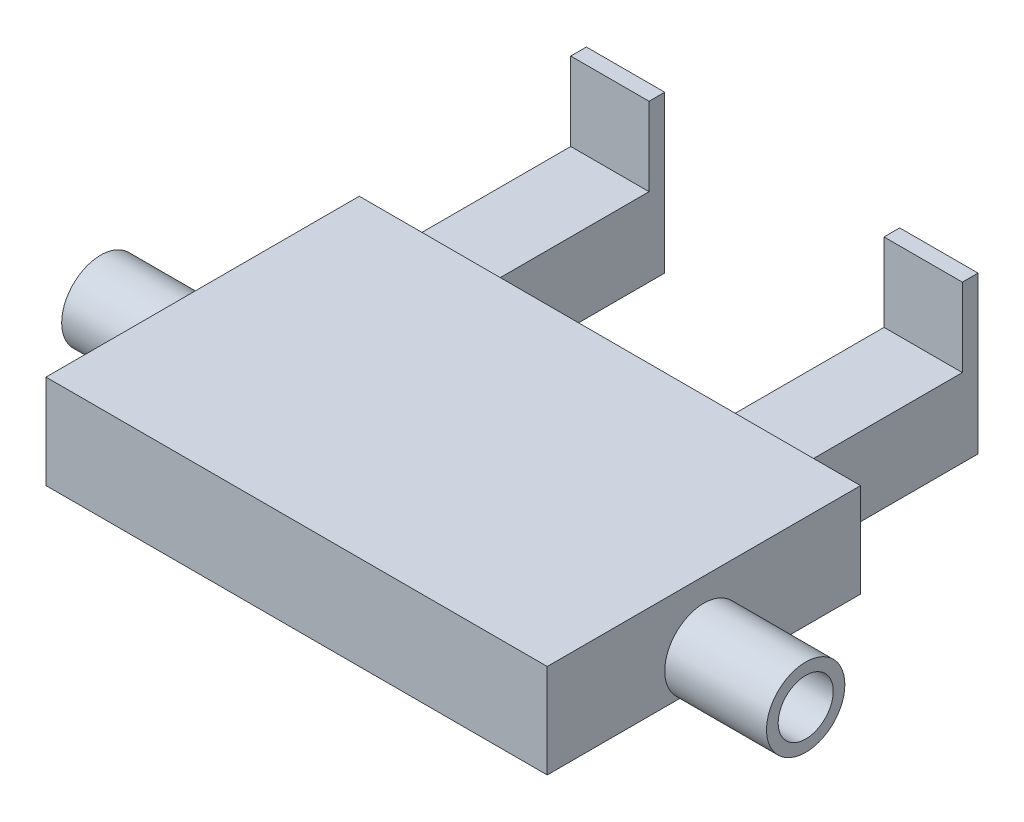
from build123d import *

# Parameters (mm, degrees)
SKETCH1_W           = 64
SKETCH1_H           = 40
BOSS_EXTRUDE1_DEPTH = 12
SKETCH2_R           = 5
SKETCH2_R_2         = 3.515
BOSS_EXTRUDE2_DEPTH = 13
BOSS_EXTRUDE3_START = 13
SKETCH3_R           = 5
SKETCH3_R_2         = 3.515
BOSS_EXTRUDE3_DEPTH = 13
SKETCH5_W           = 10
SKETCH5_H           = 10
BOSS_EXTRUDE4_DEPTH = 22
SKETCH6_W           = 10
SKETCH6_H           = 2
BOSS_EXTRUDE5_DEPTH = 10


with BuildPart() as part:
    # Sketch1 → Boss-Extrude1 (new body)
    with BuildSketch(Plane(origin=(0, 0, 0), x_dir=(1, 0, 0), z_dir=(0, 1, 0))):
        Rectangle(SKETCH1_W, SKETCH1_H)
    extrude(amount=BOSS_EXTRUDE1_DEPTH)

    # Sketch2 → Boss-Extrude2 (add)
    with BuildSketch(Plane(origin=(32, 0, 0), x_dir=(0, 0, -1), z_dir=(1, 0, 0))):
        with Locations(Location((0, 4, 0), (0, 0, 233.130102354))):
            Circle(SKETCH2_R)
        with Locations(Location((0, 4, 0), (0, 0, 180))):
            Circle(SKETCH2_R_2, mode=Mode.SUBTRACT)
    extrude(amount=BOSS_EXTRUDE2_DEPTH)

    # Sketch3 → Boss-Extrude3 (add)
    with BuildSketch(Plane.ZY.offset(32).offset(BOSS_EXTRUDE3_START)):
        with Locations(Location((0, 4, 0), (0, 0, 306.869897646))):
            Circle(SKETCH3_R)
        with Locations((0, 4)):
            Circle(SKETCH3_R_2, mode=Mode.SUBTRACT)
    extrude(amount=-BOSS_EXTRUDE3_DEPTH)

    # Sketch5 → Boss-Extrude4 (add)
    with BuildSketch(Plane(origin=(0, 0, -20), x_dir=(-1, 0, 0), z_dir=(0, 0, -1))):
        with Locations((-20, 6)):
            Rectangle(SKETCH5_W, SKETCH5_H)
        with Locations((20, 6)):
            Rectangle(SKETCH5_W, SKETCH5_H)
    extrude(amount=BOSS_EXTRUDE4_DEPTH)

    # Sketch6 → Boss-Extrude5 (add)
    with BuildSketch(Plane(origin=(0, 11, 0), x_dir=(1, 0, 0), z_dir=(0, 1, 0))):
        with Locations((20, 41)):
            Rectangle(SKETCH6_W, SKETCH6_H)
        with Locations((-20, 41)):
            Rectangle(SKETCH6_W, SKETCH6_H)
    extrude(amount=BOSS_EXTRUDE5_DEPTH)


solid = part.part
